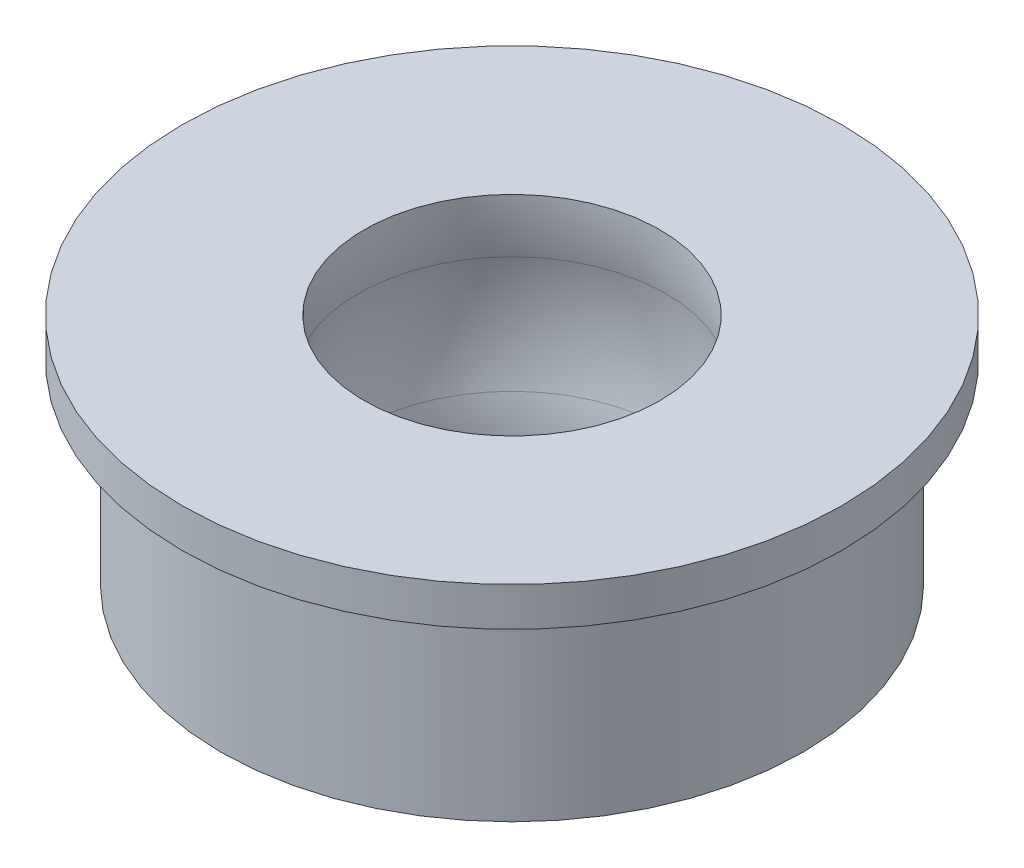
from build123d import *

# Parameters (mm, degrees)
SKETCH1_R           = 6
SKETCH1_R_2         = 3.05
BOSS_EXTRUDE1_DEPTH = 4
SKETCH2_R           = 6.8
SKETCH2_R_2         = 3.05
BOSS_EXTRUDE2_DEPTH = 0.8


with BuildPart() as part:
    # Sketch1 → Boss-Extrude1 (new body)
    with BuildSketch(Plane(origin=(0, 0, 0), x_dir=(1, 0, 0), z_dir=(0, 1, 0))):
        with Locations(Location((0, 0, 0), (0, 0, 270))):
            Circle(SKETCH1_R)
        with Locations(Location((0, 0, 0), (0, 0, 270))):
            Circle(SKETCH1_R_2, mode=Mode.SUBTRACT)
    extrude(amount=BOSS_EXTRUDE1_DEPTH)

    # Sketch2 → Boss-Extrude2 (add)
    with BuildSketch(Plane(origin=(0, 4, 0), x_dir=(1, 0, 0), z_dir=(0, 1, 0))):
        with Locations(Location((0, 0, 0), (0, 0, 270))):
            Circle(SKETCH2_R)
        with Locations(Location((0, 0, 0), (0, 0, 270))):
            Circle(SKETCH2_R_2, mode=Mode.SUBTRACT)
    extrude(amount=BOSS_EXTRUDE2_DEPTH)

    # Sketch3 → Cut-Revolve1 (revolve, cut)
    with BuildSketch(Plane.XY, mode=Mode.PRIVATE) as cut_revolve1_sk:
        with BuildLine():
            Line((-3.05, 0), (-3.05, 4.8))
            ThreePointArc((-3.05, 4.8), (-3.080331229, 4.196956564), (-3.171018764, 3.6))
            ThreePointArc((-3.171018764, 3.6), (-3.292037528, 2.4), (-3.171018764, 1.2))
            ThreePointArc((-3.171018764, 1.2), (-3.080331229, 0.603043436), (-3.05, 0))
        make_face()
    revolve(cut_revolve1_sk.sketch.rotate(Axis((0, 0, 0), (0, 1, 0)), 180), axis=Axis((0, 0, 0), (0, 1, 0)), mode=Mode.SUBTRACT)


solid = part.part
